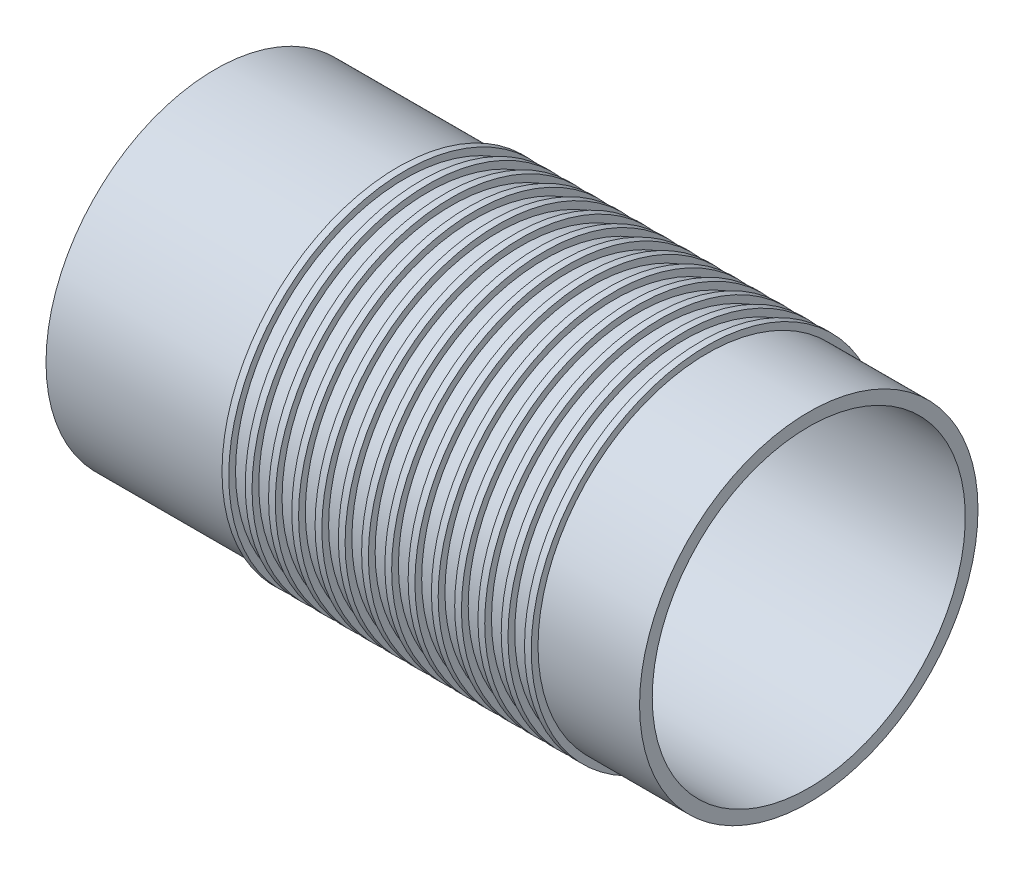
from build123d import *


with BuildPart() as part:
    # Sketch1 → Revolve1 (revolve)
    with BuildSketch(Plane.XY, mode=Mode.PRIVATE) as revolve1_sk:
        Polygon((-35.075, 18.5), (35.075, 18.5), (35.075, 20), (23.075, 20), (23.075, 20.8), (22.275, 20.8), (22.275, 20), (20.325, 20), (20.325, 20.8), (19.525, 20.8), (19.525, 20), (17.575, 20), (17.575, 20.8), (16.775, 20.8), (16.775, 20), (14.825, 20), (14.825, 20.8), (14.025, 20.8), (14.025, 20), (12.075, 20), (12.075, 20.8), (11.275, 20.8), (11.275, 20), (9.325, 20), (9.325, 20.8), (8.525, 20.8), (8.525, 20), (6.575, 20), (6.575, 20.8), (5.775, 20.8), (5.775, 20), (3.825, 20), (3.825, 20.8), (3.025, 20.8), (3.025, 20), (1.075, 20), (1.075, 20.8), (0.275, 20.8), (0.275, 20), (-1.675, 20), (-1.675, 20.8), (-2.475, 20.8), (-2.475, 20), (-4.425, 20), (-4.425, 20.8), (-5.225, 20.8), (-5.225, 20), (-7.175, 20), (-7.175, 20.8), (-7.975, 20.8), (-7.975, 20), (-9.925, 20), (-9.925, 20.8), (-10.725, 20.8), (-10.725, 20), (-12.675, 20), (-12.675, 20.8), (-13.475, 20.8), (-13.475, 20), (-35.075, 20), align=None)
    revolve(revolve1_sk.sketch.rotate(Axis((-100.187905083, 0, 0), (1, 0, 0)), 90), axis=Axis((-100.187905083, 0, 0), (1, 0, 0)))


solid = part.part
